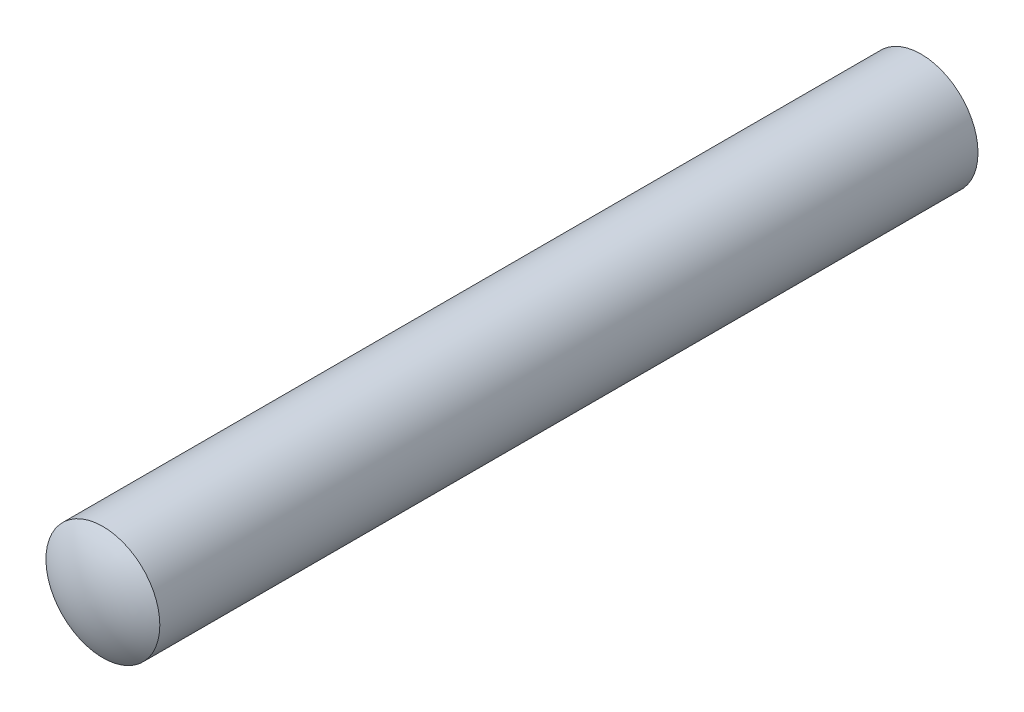
from build123d import *


with BuildPart() as part:
    # 草圖1 → 旋轉1 (revolve)
    with BuildSketch(Plane(origin=(0, 0, 0), x_dir=(0, 0, -1), z_dir=(1, 0, 0))):
        with BuildLine():
            Line((-14.37, 2), (14.37, 2))
            ThreePointArc((14.37, 2), (14.838775607, 1.048439316), (15, 0))
            Line((15, 0), (-15, 0))
            ThreePointArc((-15, 0), (-14.838775607, 1.048439316), (-14.37, 2))
        make_face()
    revolve(axis=Axis((0, 0, 15), (0, 0, -1)))


solid = part.part
